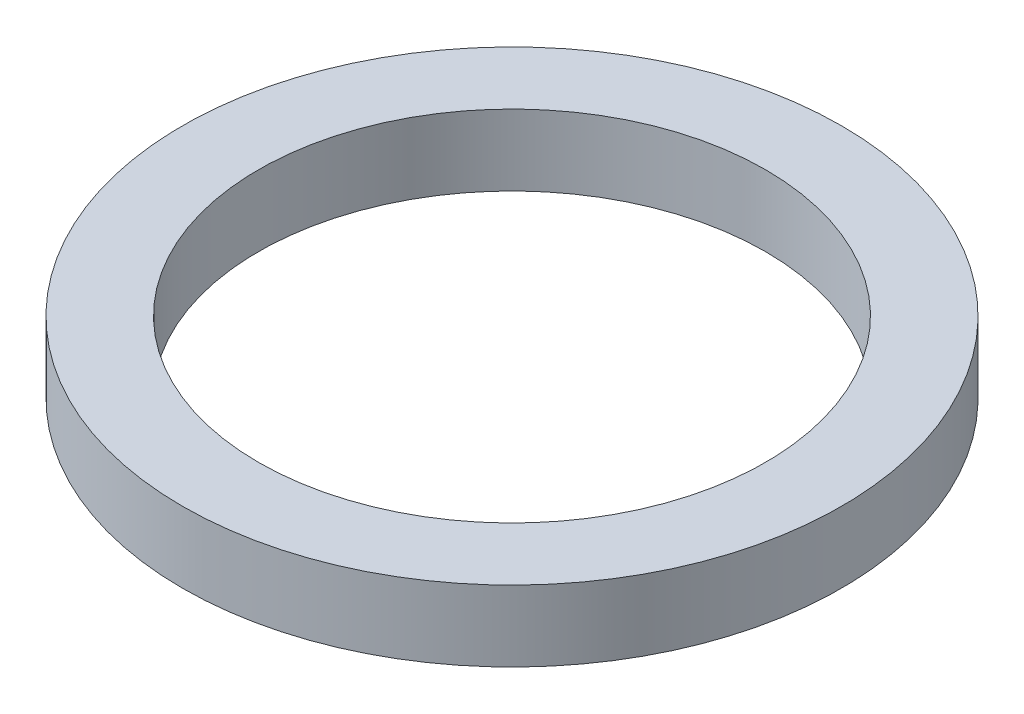
from build123d import *

# Parameters (mm, degrees)
SKETCH_1_R      = 32.5
SKETCH_1_R_2    = 25
EXTRUDE_1_DEPTH = 7


with BuildPart() as part:
    # 草图1 → 凸台-拉伸1 (new body)
    with BuildSketch(Plane(origin=(0, 0, 0), x_dir=(1, 0, 0), z_dir=(0, 1, 0))):
        with Locations(Location((0, 0, 0), (0, 0, 270))):
            Circle(SKETCH_1_R)
        with Locations(Location((0, 0, 0), (0, 0, 270))):
            Circle(SKETCH_1_R_2, mode=Mode.SUBTRACT)
    extrude(amount=EXTRUDE_1_DEPTH)


solid = part.part
